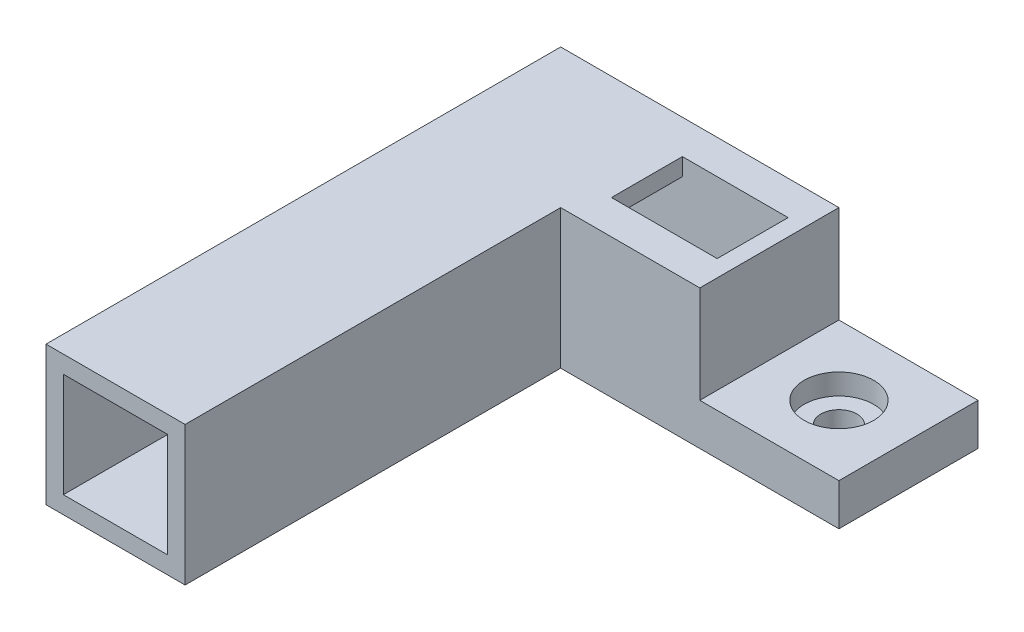
from build123d import *

# Parameters (mm, degrees)
SKETCH_1_W          = 60
SKETCH_1_H          = 20
EXTRUDE_1_DEPTH     = 6
CUT_EXTRUDE_1_DEPTH = 6
SKETCH_3_R          = 5
CUT_EXTRUDE_2_DEPTH = 3
EXTRUDE_2_DEPTH     = 14
CUT_EXTRUDE_3_DEPTH = 20
SKETCH_6_W          = 20
SKETCH_6_H          = 20
EXTRUDE_3_DEPTH     = 14
SKETCH_7_W          = 20
SKETCH_7_H          = 20
EXTRUDE_4_DEPTH     = 54
SKETCH_8_W          = 15
SKETCH_8_H          = 15
CUT_EXTRUDE_4_DEPTH = 64
SKETCH_9_W          = 19.9
SKETCH_9_H          = 10.2
CUT_EXTRUDE_5_DEPTH = 17.5
SKETCH_11_W         = 19.9
SKETCH_11_H         = 10.2
CUT_EXTRUDE_6_DEPTH = 15
SKETCH_12_W         = 35.1
SKETCH_12_H         = 10.2
EXTRUDE_5_DEPTH     = 2.5
CUT_EXTRUDE_7_DEPTH = 2.5


with BuildPart() as part:
    # 草图1 → 凸台-拉伸1 (new body)
    with BuildSketch(Plane(origin=(0, 0, 0), x_dir=(1, 0, 0), z_dir=(0, 1, 0))):
        Rectangle(SKETCH_1_W, SKETCH_1_H)
    extrude(amount=EXTRUDE_1_DEPTH)

    # 草图2 → 切除-拉伸1 (cut)
    with BuildSketch(Plane(origin=(0, 6, 0), x_dir=(1, 0, 0), z_dir=(0, 1, 0))):
        with BuildLine():
            ThreePointArc((22.6, 0), (20, 2.6), (17.4, 0))
            Line((17.4, 0), (22.6, 0))
        make_face()
        with BuildLine():
            Line((22.6, 0), (17.4, 0))
            ThreePointArc((17.4, 0), (20, -2.6), (22.6, 0))
        make_face()
    extrude(amount=-CUT_EXTRUDE_1_DEPTH, mode=Mode.SUBTRACT)

    # 草图3 → 切除-拉伸2 (cut)
    with BuildSketch(Plane(origin=(0, 6, 0), x_dir=(1, 0, 0), z_dir=(0, 1, 0))):
        with Locations(Location((20, 0, 0), (0, 0, 270))):
            Circle(SKETCH_3_R)
    extrude(amount=-CUT_EXTRUDE_2_DEPTH, mode=Mode.SUBTRACT)

    # 草图4 → 凸台-拉伸2 (add)
    with BuildSketch(Plane(origin=(0, 6, 0), x_dir=(1, 0, 0), z_dir=(0, 1, 0))):
        Polygon((-10, -10), (0, -10), (10, -10), (10, 10), (0, 10), (-10, 10), align=None)
    extrude(amount=EXTRUDE_2_DEPTH)

    # 草图5 → 切除-拉伸3 (cut)
    with BuildSketch(Plane(origin=(0, 20, 0), x_dir=(1, 0, 0), z_dir=(0, 1, 0))):
        Polygon((-7.6, 0), (0, 0), (7.6, 0), (7.6, 5.1), (-7.6, 5.1), align=None)
        Polygon((7.6, 0), (0, 0), (-7.6, 0), (-7.6, -5.1), (7.6, -5.1), align=None)
    extrude(amount=-CUT_EXTRUDE_3_DEPTH, mode=Mode.SUBTRACT)

    # 草图6 → 凸台-拉伸3 (add)
    with BuildSketch(Plane(origin=(0, 6, 0), x_dir=(1, 0, 0), z_dir=(0, 1, 0))):
        with Locations((-20, 0)):
            Rectangle(SKETCH_6_W, SKETCH_6_H)
    extrude(amount=EXTRUDE_3_DEPTH)

    # 草图7 → 凸台-拉伸4 (add)
    with BuildSketch(Plane.XY.offset(10)):
        with Locations((-20, 10)):
            Rectangle(SKETCH_7_W, SKETCH_7_H)
    extrude(amount=EXTRUDE_4_DEPTH)

    # 草图8 → 切除-拉伸4 (cut)
    with BuildSketch(Plane.XY.offset(64)):
        with Locations((-20, 10)):
            Rectangle(SKETCH_8_W, SKETCH_8_H)
    extrude(amount=-CUT_EXTRUDE_4_DEPTH, mode=Mode.SUBTRACT)

    # 草图9 → 切除-拉伸5 (cut)
    with BuildSketch(Plane(origin=(0, 20, 0), x_dir=(1, 0, 0), z_dir=(0, 1, 0))):
        with Locations((-17.55, 0)):
            Rectangle(SKETCH_9_W, SKETCH_9_H)
    extrude(amount=-CUT_EXTRUDE_5_DEPTH, mode=Mode.SUBTRACT)

    # 草图11 → 切除-拉伸6 (cut)
    with BuildSketch(Plane(origin=(0, 2.5, 0), x_dir=(1, 0, 0), z_dir=(0, 1, 0))):
        with Locations((-17.55, 0)):
            Rectangle(SKETCH_11_W, SKETCH_11_H)
    extrude(amount=-CUT_EXTRUDE_6_DEPTH, mode=Mode.SUBTRACT)

    # 草图12 → 凸台-拉伸5 (add)
    with BuildSketch(Plane(origin=(0, 20, 0), x_dir=(1, 0, 0), z_dir=(0, 1, 0))):
        with Locations((-9.95, 0)):
            Rectangle(SKETCH_12_W, SKETCH_12_H)
    extrude(amount=-EXTRUDE_5_DEPTH)

    # 草图13 → 切除-拉伸7 (cut)
    with BuildSketch(Plane(origin=(0, 20, 0), x_dir=(1, 0, 0), z_dir=(0, 1, 0))):
        Polygon((-7.6, 0), (0, 0), (7.6, 0), (7.6, 5.1), (-7.6, 5.1), align=None)
        Polygon((7.6, 0), (0, 0), (-7.6, 0), (-7.6, -5.1), (7.6, -5.1), align=None)
    extrude(amount=-CUT_EXTRUDE_7_DEPTH, mode=Mode.SUBTRACT)


solid = part.part
